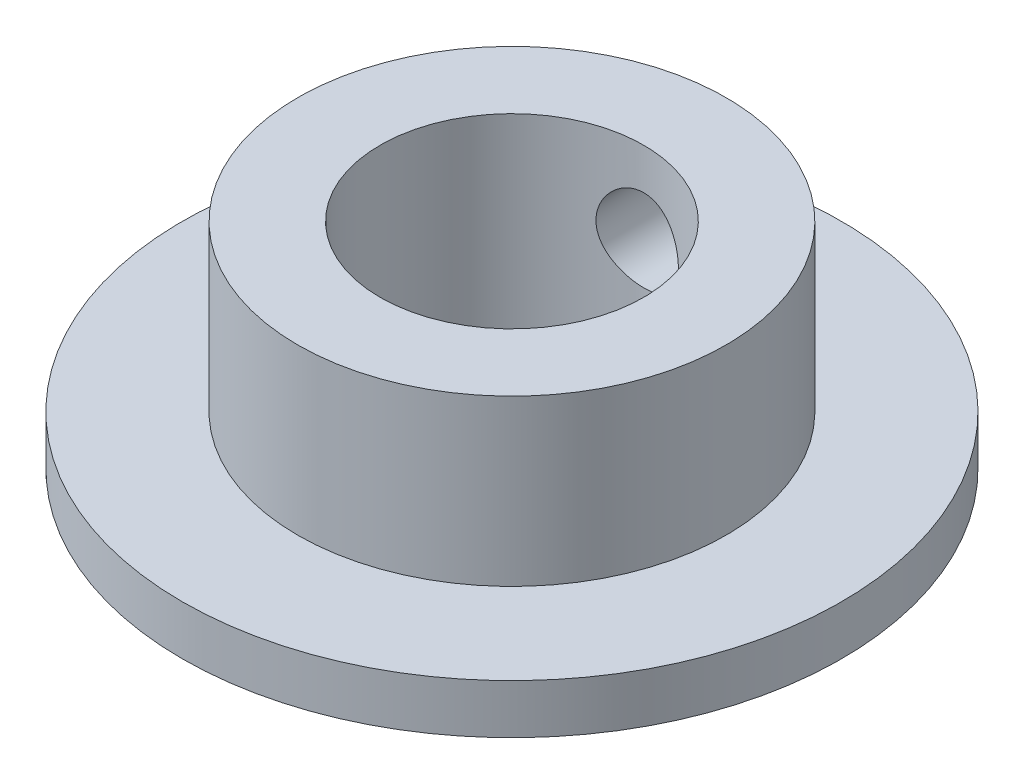
from build123d import *

# Parameters (mm, degrees)
SKETCH1_R           = 20
SKETCH1_R_2         = 8
BOSS_EXTRUDE1_DEPTH = 3
SKETCH2_R           = 13
SKETCH2_R_2         = 8
BOSS_EXTRUDE2_DEPTH = 10
SKETCH3_R           = 2.5
CUT_EXTRUDE1_DEPTH  = 32.128764833


with BuildPart() as part:
    # Sketch1 → Boss-Extrude1 (new body)
    with BuildSketch(Plane(origin=(0, 0, 0), x_dir=(1, 0, 0), z_dir=(0, 1, 0))):
        with Locations(Location((0, 0, 0), (0, 0, 270))):
            Circle(SKETCH1_R)
        with Locations(Location((0, 0, 0), (0, 0, 270))):
            Circle(SKETCH1_R_2, mode=Mode.SUBTRACT)
    extrude(amount=BOSS_EXTRUDE1_DEPTH)

    # Sketch2 → Boss-Extrude2 (add)
    with BuildSketch(Plane(origin=(0, 3, 0), x_dir=(1, 0, 0), z_dir=(0, 1, 0))):
        with Locations(Location((0, 0, 0), (0, 0, 270))):
            Circle(SKETCH2_R)
        with Locations(Location((0, 0, 0), (0, 0, 270))):
            Circle(SKETCH2_R_2, mode=Mode.SUBTRACT)
    extrude(amount=BOSS_EXTRUDE2_DEPTH)

    # Sketch3 → Cut-Extrude1 (cut, through all)
    with BuildSketch(Plane.XY):
        with Locations(Location((0, 8, 0), (0, 0, 90))):
            Circle(SKETCH3_R)
    extrude(amount=-CUT_EXTRUDE1_DEPTH, mode=Mode.SUBTRACT)


solid = part.part
